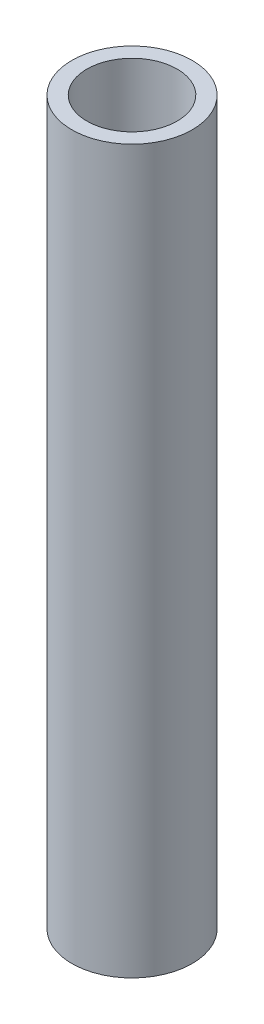
from build123d import *

# Parameters (mm, degrees)
SKETCH1_R           = 25.4
SKETCH1_R_2         = 19.05
BOSS_EXTRUDE1_DEPTH = 304.8
SKETCH3_W           = 5.1054
SKETCH3_H           = 12.7


with BuildPart() as part:
    # Sketch1 → Boss-Extrude1 (new body)
    with BuildSketch(Plane(origin=(0, 0, 0), x_dir=(1, 0, 0), z_dir=(0, 1, 0))):
        with Locations(Location((0, 0, 0), (0, 0, 90))):
            Circle(SKETCH1_R)
        with Locations(Location((0, 0, 0), (0, 0, 90))):
            Circle(SKETCH1_R_2, mode=Mode.SUBTRACT)
    extrude(amount=BOSS_EXTRUDE1_DEPTH)

    # Sketch3 → Cut-Revolve1 (revolve, cut)
    with BuildSketch(Plane.XY, mode=Mode.PRIVATE) as cut_revolve1_sk:
        with Locations((21.6027, 6.35)):
            Rectangle(SKETCH3_W, SKETCH3_H)
    revolve(cut_revolve1_sk.sketch.rotate(Axis((0, 0, 0), (0, 1, 0)), 90), axis=Axis((0, 0, 0), (0, 1, 0)), mode=Mode.SUBTRACT)


solid = part.part
